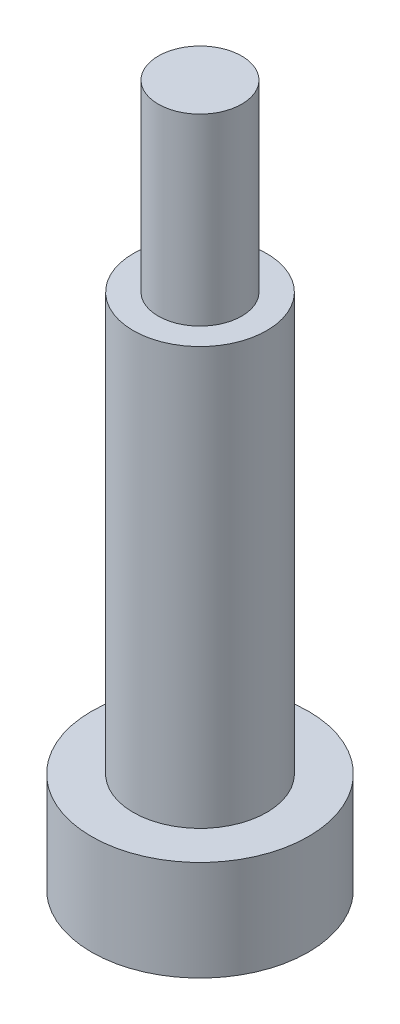
from build123d import *

# Parameters (mm, degrees)
ROSCA_START  = -3.175
CROQUIS1_R   = 2.5
ROSCA_DEPTH  = 11
HOMBRO_START = -28.175
CROQUIS2_R   = 4
HOMBRO_DEPTH = 25
CABEZA_START = -34.175
CROQUIS3_R   = 6.5
CABEZA_DEPTH = 6
ALLEN_START  = -34.175
CROQUIS4_R   = 2.86
ALLEN_DEPTH  = 3.6


with BuildPart() as part:
    # Croquis1 → Rosca (new body)
    with BuildSketch(Plane(origin=(0, 0, 0), x_dir=(1, 0, 0), z_dir=(0, 1, 0)).offset(ROSCA_START)):
        with Locations(Location((152.4, -336.55, 0), (0, 0, 270))):
            Circle(CROQUIS1_R)
    extrude(amount=ROSCA_DEPTH)

    # Croquis2 → Hombro (add)
    with BuildSketch(Plane(origin=(0, 0, 0), x_dir=(1, 0, 0), z_dir=(0, 1, 0)).offset(HOMBRO_START)):
        with Locations(Location((152.4, -336.55, 0), (0, 0, 270))):
            Circle(CROQUIS2_R)
    extrude(amount=HOMBRO_DEPTH)

    # Croquis3 → Cabeza (add)
    with BuildSketch(Plane(origin=(0, 0, 0), x_dir=(1, 0, 0), z_dir=(0, 1, 0)).offset(CABEZA_START)):
        with Locations(Location((152.4, -336.55, 0), (0, 0, 270))):
            Circle(CROQUIS3_R)
    extrude(amount=CABEZA_DEPTH)

    # Croquis4 → Allen (cut)
    with BuildSketch(Plane(origin=(0, 0, 0), x_dir=(1, 0, 0), z_dir=(0, 1, 0)).offset(ALLEN_START)):
        with Locations(Location((152.4, -336.55, 0), (0, 0, 270))):
            Circle(CROQUIS4_R)
    extrude(amount=ALLEN_DEPTH, mode=Mode.SUBTRACT)


solid = part.part
